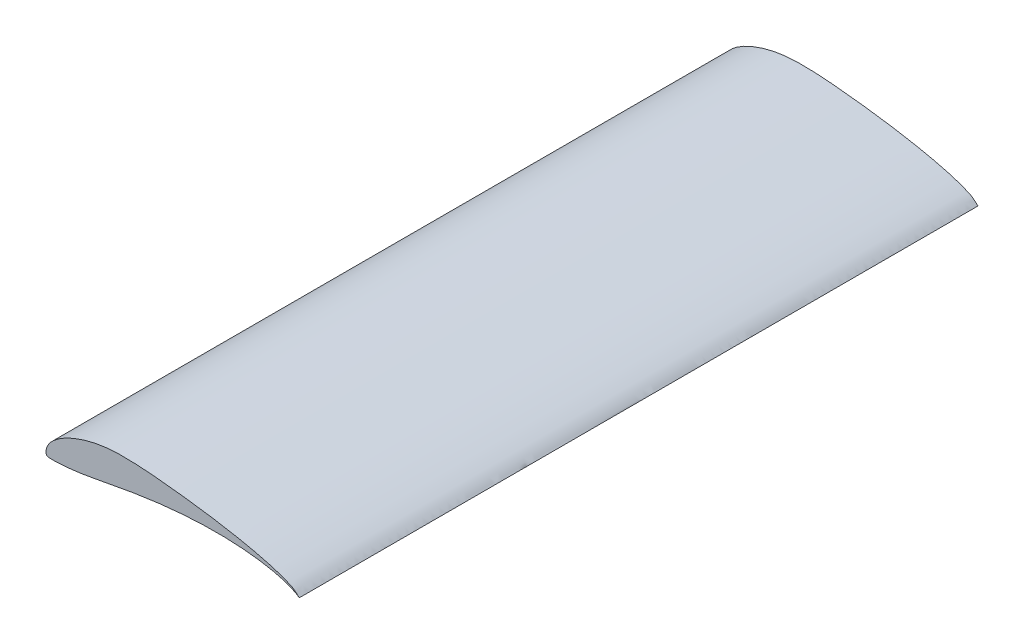
from build123d import *

# Parameters (mm, degrees)
BOSS_EXTRUDE1_DEPTH = 952.5


with BuildPart() as part:
    # Sketch1 → Boss-Extrude1 (new body)
    with BuildSketch(Plane.XY):
        with BuildLine():
            add(Edge.make_bspline(
                [(355.6, 0), (355.602128839, 0.009052579), (354.433140978, 0.880028161), (353.444501711, 1.850054552), (351.249323177, 3.876145696), (348.659525752, 6.03151925), (345.116905318, 8.204375607), (340.711629883, 10.31011906), (335.393425674, 12.507717409), (329.170399196, 14.766571131), (322.071582725, 17.070723103), (314.133828695, 19.400167793), (305.401586316, 21.743971907), (295.923071256, 24.080614847), (285.752626316, 26.393181766), (274.950869855, 28.667228387), (263.583762409, 30.891064371), (251.717739616, 33.037324106), (239.427524052, 35.1029412), (226.78394521, 37.061316863), (213.868769442, 38.916275205), (200.764767607, 40.653116607), (187.566852051, 42.266283273), (174.380530099, 43.767197295), (161.314964857, 45.117986738), (148.476599483, 46.293370041), (135.955728548, 47.227190212), (123.823875864, 47.869538638), (112.148534892, 48.146934618), (100.989516745, 48.117407628), (90.367637308, 47.571029473), (80.278781955, 46.463818754), (70.681881213, 44.898206378), (61.574618862, 42.869969366), (52.966351285, 40.491578545), (44.893501126, 37.805158859), (37.390401474, 34.873532327), (30.503677466, 31.712405529), (24.255414501, 28.385958432), (18.679605182, 24.932019165), (13.811215985, 21.397391601), (9.652255604, 17.856996449), (6.26303627, 14.272187636), (3.65968352, 10.674009682), (1.736652411, 7.173461721), (0.504192982, 3.849857283), (-0.083073996, 0.782171393), (0.030284424, -1.812363748), (0.698257612, -4.191970544), (3.181220912, -5.37322479), (6.519597672, -5.538951041), (11.086484633, -5.699573575), (16.829667297, -5.451915478), (23.684236356, -4.996795371), (31.573907611, -4.26779165), (40.41794786, -3.28141827), (50.173231241, -2.01650944), (60.834990489, -0.248611137), (72.455136797, 1.968304678), (85.091763073, 4.381016522), (98.683102519, 6.928494327), (113.14378723, 9.505000421), (128.36761742, 12.013841552), (144.236485555, 14.37124095), (160.613634462, 16.490720724), (177.351789026, 18.310566739), (194.292835689, 19.749080081), (211.266766871, 20.768808664), (228.096248564, 21.329409949), (244.598710424, 21.400217908), (260.590041642, 20.976421471), (275.887132003, 20.067941795), (290.306036162, 18.686500714), (303.675088431, 16.885124688), (315.82022803, 14.716082861), (326.599058577, 12.252019131), (335.812931174, 9.615361165), (343.353535673, 6.801292161), (348.733562878, 4.22605875), (352.700113312, 1.844911438), (354.223891421, 0.923446709), (355.597827882, -0.009236617), (355.6, 0)],
                knots=[0, 0, 0, 0, 0.000979678, 0.003648862, 0.007483499, 0.012095277, 0.017525591, 0.02405178, 0.031783051, 0.040677828, 0.050710301, 0.061833229, 0.07398925, 0.087118173, 0.101145049, 0.115990637, 0.131570422, 0.147788379, 0.164550917, 0.181757895, 0.199311955, 0.217095072, 0.234990228, 0.252856883, 0.270540594, 0.287886779, 0.304773438, 0.321101419, 0.336806063, 0.351800033, 0.366031063, 0.379615675, 0.392652963, 0.405170359, 0.417171919, 0.428603517, 0.439418959, 0.449596586, 0.459102079, 0.467907878, 0.475988301, 0.483308969, 0.489874508, 0.49580325, 0.501149412, 0.505903073, 0.510046769, 0.513579311, 0.516446927, 0.519350053, 0.523823355, 0.529973794, 0.537715654, 0.546967844, 0.557637367, 0.569620481, 0.582804124, 0.597246961, 0.613135037, 0.6304436, 0.649056124, 0.668822257, 0.689594964, 0.711189651, 0.733426689, 0.756094118, 0.778988554, 0.801889683, 0.824566598, 0.846792285, 0.868338291, 0.888978163, 0.908492011, 0.926658768, 0.943286193, 0.95816921, 0.971135822, 0.981955623, 0.990251791, 0.995852565, 0.999000406, 1, 1, 1, 1], degree=3))
        make_face()
    extrude(amount=BOSS_EXTRUDE1_DEPTH)


solid = part.part
